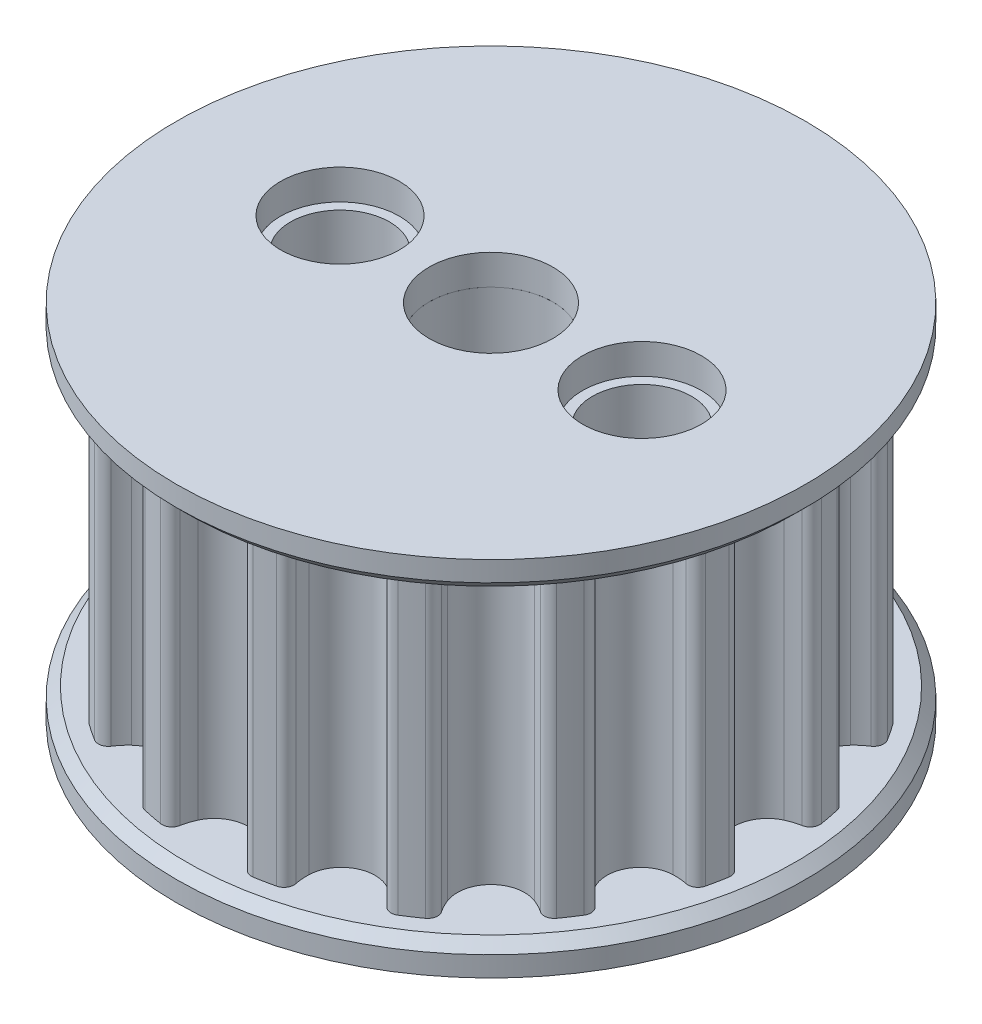
from build123d import *

# Parameters (mm, degrees)
SKETCH1_R           = 1.5625
BOSS_EXTRUDE1_DEPTH = 3.81
SKETCH2_R           = 7.9375
SKETCH2_R_2         = 1.5625
BOSS_EXTRUDE2_DEPTH = 0.762
SKETCH3_R           = 1.5
CUT_EXTRUDE1_DEPTH  = 15.009487375
SKETCH4_R           = 1.25
CUT_EXTRUDE2_DEPTH  = 14.567321493
CHAMFER1_SIZE       = 0.254


with BuildPart() as part:
    # Sketch1 → Boss-Extrude1 (new, symmetric)
    with BuildSketch(Plane(origin=(0, 0, 0), x_dir=(1, 0, 0), z_dir=(0, 1, 0))):
        with BuildLine():
            ThreePointArc((-1.850768, -6.777037356), (-1.816941892, -6.962421006), (-1.663291889, -7.071521784))
            ThreePointArc((-1.663291889, -7.071521784), (-1.417233644, -7.124914669), (-1.169472895, -7.169748489))
            ThreePointArc((-1.169472895, -7.169748489), (-0.985767742, -7.127751824), (-0.883573242, -6.969424355))
            ThreePointArc((-0.883573242, -6.969424355), (-0.839120956, -6.792881518), (-0.773880597, -6.622919538))
            ThreePointArc((-0.773880597, -6.622919538), (0, -6.1245), (0.773880597, -6.622919538))
            ThreePointArc((0.773880597, -6.622919538), (0.839120956, -6.792881518), (0.883573242, -6.969424355))
            ThreePointArc((0.883573242, -6.969424355), (0.985767742, -7.127751824), (1.169472895, -7.169748489))
            ThreePointArc((1.169472895, -7.169748489), (1.417233644, -7.124914669), (1.663291889, -7.071521784))
            ThreePointArc((1.663291889, -7.071521784), (1.816941892, -6.962421006), (1.850768, -6.777037356))
            ThreePointArc((1.850768, -6.777037356), (1.824276538, -6.596921889), (1.819509137, -6.414931089))
            ThreePointArc((1.819509137, -6.414931089), (2.343744682, -5.658300197), (3.249454025, -5.822628523))
            ThreePointArc((3.249454025, -5.822628523), (3.374769892, -5.954686513), (3.483398468, -6.100779674))
            ThreePointArc((3.483398468, -6.100779674), (3.638403174, -6.20794704), (3.824196033, -6.176445981))
            ThreePointArc((3.824196033, -6.176445981), (4.035939958, -6.040210999), (4.242835561, -5.896719991))
            ThreePointArc((4.242835561, -5.896719991), (4.343038594, -5.737124705), (4.303346591, -5.552907854))
            ThreePointArc((4.303346591, -5.552907854), (4.209944466, -5.396640704), (4.135895098, -5.230327534))
            ThreePointArc((4.135895098, -5.230327534), (4.330675481, -4.330675481), (5.230327534, -4.135895098))
            ThreePointArc((5.230327534, -4.135895098), (5.396640704, -4.209944466), (5.552907854, -4.303346591))
            ThreePointArc((5.552907854, -4.303346591), (5.737124705, -4.343038594), (5.896719991, -4.242835561))
            ThreePointArc((5.896719991, -4.242835561), (6.040210999, -4.035939958), (6.176445981, -3.824196033))
            ThreePointArc((6.176445981, -3.824196033), (6.20794704, -3.638403174), (6.100779674, -3.483398468))
            ThreePointArc((6.100779674, -3.483398468), (5.954686513, -3.374769892), (5.822628523, -3.249454025))
            ThreePointArc((5.822628523, -3.249454025), (5.658300197, -2.343744682), (6.414931089, -1.819509137))
            ThreePointArc((6.414931089, -1.819509137), (6.596921889, -1.824276538), (6.777037356, -1.850768))
            ThreePointArc((6.777037356, -1.850768), (6.962421006, -1.816941892), (7.071521784, -1.663291889))
            ThreePointArc((7.071521784, -1.663291889), (7.124914669, -1.417233644), (7.169748489, -1.169472895))
            ThreePointArc((7.169748489, -1.169472895), (7.127751824, -0.985767742), (6.969424355, -0.883573242))
            ThreePointArc((6.969424355, -0.883573242), (6.792881518, -0.839120956), (6.622919538, -0.773880597))
            ThreePointArc((6.622919538, -0.773880597), (6.1245, 0), (6.622919538, 0.773880597))
            ThreePointArc((6.622919538, 0.773880597), (6.792881518, 0.839120956), (6.969424355, 0.883573242))
            ThreePointArc((6.969424355, 0.883573242), (7.127751824, 0.985767742), (7.169748489, 1.169472895))
            ThreePointArc((7.169748489, 1.169472895), (7.124914669, 1.417233644), (7.071521784, 1.663291889))
            ThreePointArc((7.071521784, 1.663291889), (6.962421006, 1.816941892), (6.777037356, 1.850768))
            ThreePointArc((6.777037356, 1.850768), (6.596921889, 1.824276538), (6.414931089, 1.819509137))
            ThreePointArc((6.414931089, 1.819509137), (5.658300197, 2.343744682), (5.822628523, 3.249454025))
            ThreePointArc((5.822628523, 3.249454025), (5.954686513, 3.374769892), (6.100779674, 3.483398468))
            ThreePointArc((6.100779674, 3.483398468), (6.20794704, 3.638403174), (6.176445981, 3.824196033))
            ThreePointArc((6.176445981, 3.824196033), (6.040210999, 4.035939958), (5.896719991, 4.242835561))
            ThreePointArc((5.896719991, 4.242835561), (5.737124705, 4.343038594), (5.552907854, 4.303346591))
            ThreePointArc((5.552907854, 4.303346591), (5.396640704, 4.209944466), (5.230327534, 4.135895098))
            ThreePointArc((5.230327534, 4.135895098), (4.330675481, 4.330675481), (4.135895098, 5.230327534))
            ThreePointArc((4.135895098, 5.230327534), (4.209944466, 5.396640704), (4.303346591, 5.552907854))
            ThreePointArc((4.303346591, 5.552907854), (4.343038594, 5.737124705), (4.242835561, 5.896719991))
            ThreePointArc((4.242835561, 5.896719991), (4.035939958, 6.040210999), (3.824196033, 6.176445981))
            ThreePointArc((3.824196033, 6.176445981), (3.638403174, 6.20794704), (3.483398468, 6.100779674))
            ThreePointArc((3.483398468, 6.100779674), (3.374769892, 5.954686513), (3.249454025, 5.822628523))
            ThreePointArc((3.249454025, 5.822628523), (2.343744682, 5.658300197), (1.819509137, 6.414931089))
            ThreePointArc((1.819509137, 6.414931089), (1.824276538, 6.596921889), (1.850768, 6.777037356))
            ThreePointArc((1.850768, 6.777037356), (1.816941892, 6.962421006), (1.663291889, 7.071521784))
            ThreePointArc((1.663291889, 7.071521784), (1.417233644, 7.124914669), (1.169472895, 7.169748489))
            ThreePointArc((1.169472895, 7.169748489), (0.985767742, 7.127751824), (0.883573242, 6.969424355))
            ThreePointArc((0.883573242, 6.969424355), (0.839120956, 6.792881518), (0.773880597, 6.622919538))
            ThreePointArc((0.773880597, 6.622919538), (0, 6.1245), (-0.773880597, 6.622919538))
            ThreePointArc((-0.773880597, 6.622919538), (-0.839120956, 6.792881518), (-0.883573242, 6.969424355))
            ThreePointArc((-0.883573242, 6.969424355), (-0.985767742, 7.127751824), (-1.169472895, 7.169748489))
            ThreePointArc((-1.169472895, 7.169748489), (-1.417233644, 7.124914669), (-1.663291889, 7.071521784))
            ThreePointArc((-1.663291889, 7.071521784), (-1.816941892, 6.962421006), (-1.850768, 6.777037356))
            ThreePointArc((-1.850768, 6.777037356), (-1.824276538, 6.596921889), (-1.819509137, 6.414931089))
            ThreePointArc((-1.819509137, 6.414931089), (-2.343744682, 5.658300197), (-3.249454025, 5.822628523))
            ThreePointArc((-3.249454025, 5.822628523), (-3.374769892, 5.954686513), (-3.483398468, 6.100779674))
            ThreePointArc((-3.483398468, 6.100779674), (-3.638403174, 6.20794704), (-3.824196033, 6.176445981))
            ThreePointArc((-3.824196033, 6.176445981), (-4.035939958, 6.040210999), (-4.242835561, 5.896719991))
            ThreePointArc((-4.242835561, 5.896719991), (-4.343038594, 5.737124705), (-4.303346591, 5.552907854))
            ThreePointArc((-4.303346591, 5.552907854), (-4.209944466, 5.396640704), (-4.135895098, 5.230327534))
            ThreePointArc((-4.135895098, 5.230327534), (-4.330675481, 4.330675481), (-5.230327534, 4.135895098))
            ThreePointArc((-5.230327534, 4.135895098), (-5.396640704, 4.209944466), (-5.552907854, 4.303346591))
            ThreePointArc((-5.552907854, 4.303346591), (-5.737124705, 4.343038594), (-5.896719991, 4.242835561))
            ThreePointArc((-5.896719991, 4.242835561), (-6.040210999, 4.035939958), (-6.176445981, 3.824196033))
            ThreePointArc((-6.176445981, 3.824196033), (-6.20794704, 3.638403174), (-6.100779674, 3.483398468))
            ThreePointArc((-6.100779674, 3.483398468), (-5.954686513, 3.374769892), (-5.822628523, 3.249454025))
            ThreePointArc((-5.822628523, 3.249454025), (-5.658300197, 2.343744682), (-6.414931089, 1.819509137))
            ThreePointArc((-6.414931089, 1.819509137), (-6.596921889, 1.824276538), (-6.777037356, 1.850768))
            ThreePointArc((-6.777037356, 1.850768), (-6.962421006, 1.816941892), (-7.071521784, 1.663291889))
            ThreePointArc((-7.071521784, 1.663291889), (-7.124914669, 1.417233644), (-7.169748489, 1.169472895))
            ThreePointArc((-7.169748489, 1.169472895), (-7.127751824, 0.985767742), (-6.969424355, 0.883573242))
            ThreePointArc((-6.969424355, 0.883573242), (-6.792881518, 0.839120956), (-6.622919538, 0.773880597))
            ThreePointArc((-6.622919538, 0.773880597), (-6.1245, 0), (-6.622919538, -0.773880597))
            ThreePointArc((-6.622919538, -0.773880597), (-6.792881518, -0.839120956), (-6.969424355, -0.883573242))
            ThreePointArc((-6.969424355, -0.883573242), (-7.127751824, -0.985767742), (-7.169748489, -1.169472895))
            ThreePointArc((-7.169748489, -1.169472895), (-7.124914669, -1.417233644), (-7.071521784, -1.663291889))
            ThreePointArc((-7.071521784, -1.663291889), (-6.962421006, -1.816941892), (-6.777037356, -1.850768))
            ThreePointArc((-6.777037356, -1.850768), (-6.596921889, -1.824276538), (-6.414931089, -1.819509137))
            ThreePointArc((-6.414931089, -1.819509137), (-5.658300197, -2.343744682), (-5.822628523, -3.249454025))
            ThreePointArc((-5.822628523, -3.249454025), (-5.954686513, -3.374769892), (-6.100779674, -3.483398468))
            ThreePointArc((-6.100779674, -3.483398468), (-6.20794704, -3.638403174), (-6.176445981, -3.824196033))
            ThreePointArc((-6.176445981, -3.824196033), (-6.040210999, -4.035939958), (-5.896719991, -4.242835561))
            ThreePointArc((-5.896719991, -4.242835561), (-5.737124705, -4.343038594), (-5.552907854, -4.303346591))
            ThreePointArc((-5.552907854, -4.303346591), (-5.396640704, -4.209944466), (-5.230327534, -4.135895098))
            ThreePointArc((-5.230327534, -4.135895098), (-4.330675481, -4.330675481), (-4.135895098, -5.230327534))
            ThreePointArc((-4.135895098, -5.230327534), (-4.209944466, -5.396640704), (-4.303346591, -5.552907854))
            ThreePointArc((-4.303346591, -5.552907854), (-4.343038594, -5.737124705), (-4.242835561, -5.896719991))
            ThreePointArc((-4.242835561, -5.896719991), (-4.035939958, -6.040210999), (-3.824196033, -6.176445981))
            ThreePointArc((-3.824196033, -6.176445981), (-3.638403174, -6.20794704), (-3.483398468, -6.100779674))
            ThreePointArc((-3.483398468, -6.100779674), (-3.374769892, -5.954686513), (-3.249454025, -5.822628523))
            ThreePointArc((-3.249454025, -5.822628523), (-2.343744682, -5.658300197), (-1.819509137, -6.414931089))
            ThreePointArc((-1.819509137, -6.414931089), (-1.824276538, -6.596921889), (-1.850768, -6.777037356))
        make_face()
        with Locations(Location((0, 0, 0), (0, 0, 90))):
            Circle(SKETCH1_R, mode=Mode.SUBTRACT)
    extrude(amount=BOSS_EXTRUDE1_DEPTH, both=True)

    # Sketch4 → Cut-Extrude2 (cut, through all)
    with BuildSketch(Plane.XZ.offset(3.81)):
        with Locations(Location((-3.81, 0, 0), (0, 0, 270))):
            Circle(SKETCH4_R)
        with Locations(Location((3.81, 0, 0), (0, 0, 270))):
            Circle(SKETCH4_R)
    extrude(amount=-CUT_EXTRUDE2_DEPTH, mode=Mode.SUBTRACT)


with BuildPart() as body_2:
    # Sketch2 → Boss-Extrude2 (new body)
    with BuildSketch(Plane.XZ.offset(3.81)):
        with Locations(Location((0, 0, 0), (0, 0, 90))):
            Circle(SKETCH2_R)
        with Locations(Location((0, 0, 0), (0, 0, 90))):
            Circle(SKETCH2_R_2, mode=Mode.SUBTRACT)
    extrude(amount=BOSS_EXTRUDE2_DEPTH)

    # Sketch3 → Cut-Extrude1 (cut, through all)
    with BuildSketch(Plane.XZ.offset(4.572)):
        with Locations(Location((-3.81, 0, 0), (0, 0, 270))):
            Circle(SKETCH3_R)
        with Locations(Location((3.81, 0, 0), (0, 0, 270))):
            Circle(SKETCH3_R)
    extrude(amount=-CUT_EXTRUDE1_DEPTH, mode=Mode.SUBTRACT)

    # Chamfer1
    chamfer1_edges = [body_2.edges().sort_by_distance(p)[0] for p in [
        (0, -3.81, -7.9375),
    ]]
    chamfer(chamfer1_edges, length=CHAMFER1_SIZE)


with BuildPart() as body_3:
    # Mirror2: mirrored copy
    add(body_2.part.mirror(Plane.ZX))


solid = Compound([part.part, body_2.part, body_3.part])
